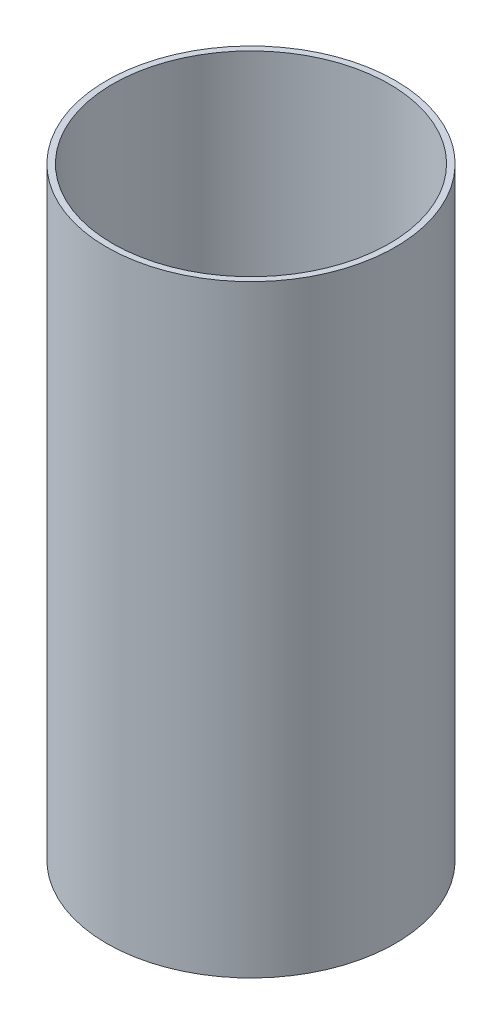
from build123d import *

# Parameters (mm, degrees)
SKETCH1_R           = 35.9
SKETCH1_R_2         = 34.4
BOSS_EXTRUDE1_DEPTH = 150


with BuildPart() as part:
    # Sketch1 → Boss-Extrude1 (new body)
    with BuildSketch(Plane(origin=(0, 0, 0), x_dir=(1, 0, 0), z_dir=(0, 1, 0))):
        with Locations(Location((-16.547739432, 0, 0), (0, 0, 270))):
            Circle(SKETCH1_R)
        with Locations(Location((-16.547739432, 0, 0), (0, 0, 270))):
            Circle(SKETCH1_R_2, mode=Mode.SUBTRACT)
    extrude(amount=BOSS_EXTRUDE1_DEPTH)


solid = part.part
